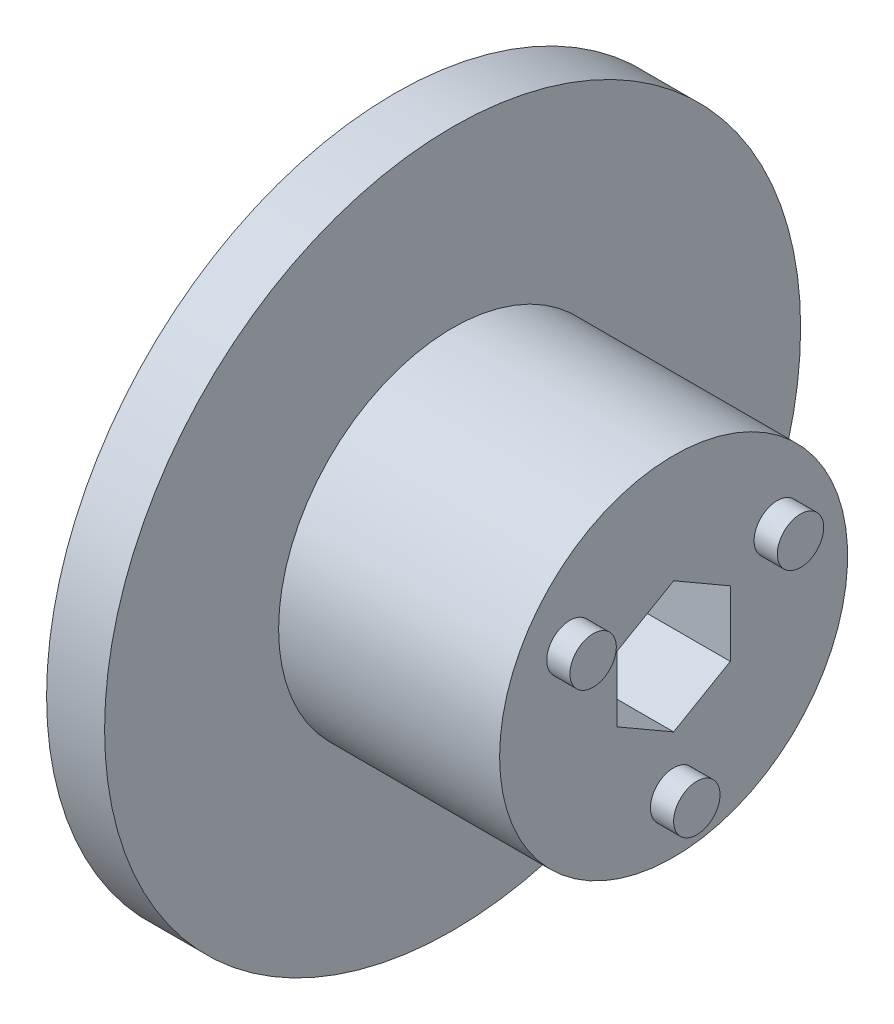
from build123d import *

# Parameters (mm, degrees)
SKETCH2_R           = 30
BOSS_EXTRUDE1_DEPTH = 5
SKETCH3_R           = 15
BOSS_EXTRUDE2_DEPTH = 19.05
CUT_EXTRUDE1_DEPTH  = 24.05
SKETCH5_R           = 2
BOSS_EXTRUDE3_DEPTH = 2


with BuildPart() as part:
    # Sketch2 → Boss-Extrude1 (new body)
    with BuildSketch(Plane(origin=(0, 0, 0), x_dir=(0, 0, -1), z_dir=(1, 0, 0))):
        Circle(SKETCH2_R)
    extrude(amount=BOSS_EXTRUDE1_DEPTH)

    # Sketch3 → Boss-Extrude2 (add)
    with BuildSketch(Plane(origin=(5, 0, 0), x_dir=(0, 0, -1), z_dir=(1, 0, 0))):
        with Locations(Location((0, 0, 0), (0, 0, 180))):
            Circle(SKETCH3_R)
    extrude(amount=BOSS_EXTRUDE2_DEPTH)

    # Sketch4 → Cut-Extrude1 (cut)
    with BuildSketch(Plane(origin=(24.05, 0, 0), x_dir=(0, 0, -1), z_dir=(1, 0, 0))):
        Polygon((0, 5.64071213), (-4.885, 2.820356065), (-4.885, -2.820356065), (0, -5.64071213), (4.885, -2.820356065), (4.885, 2.820356065), align=None)
    extrude(amount=-CUT_EXTRUDE1_DEPTH, mode=Mode.SUBTRACT)

    # Sketch5 → Boss-Extrude3 (add)
    with BuildSketch(Plane(origin=(24.05, 0, 0), x_dir=(0, 0, -1), z_dir=(1, 0, 0))):
        with Locations((8.937690528, 5.160178032)):
            Circle(SKETCH5_R)
        with Locations((-8.937690528, 5.160178032)):
            Circle(SKETCH5_R)
        with Locations((0, -10.320356065)):
            Circle(SKETCH5_R)
    extrude(amount=BOSS_EXTRUDE3_DEPTH)


solid = part.part
